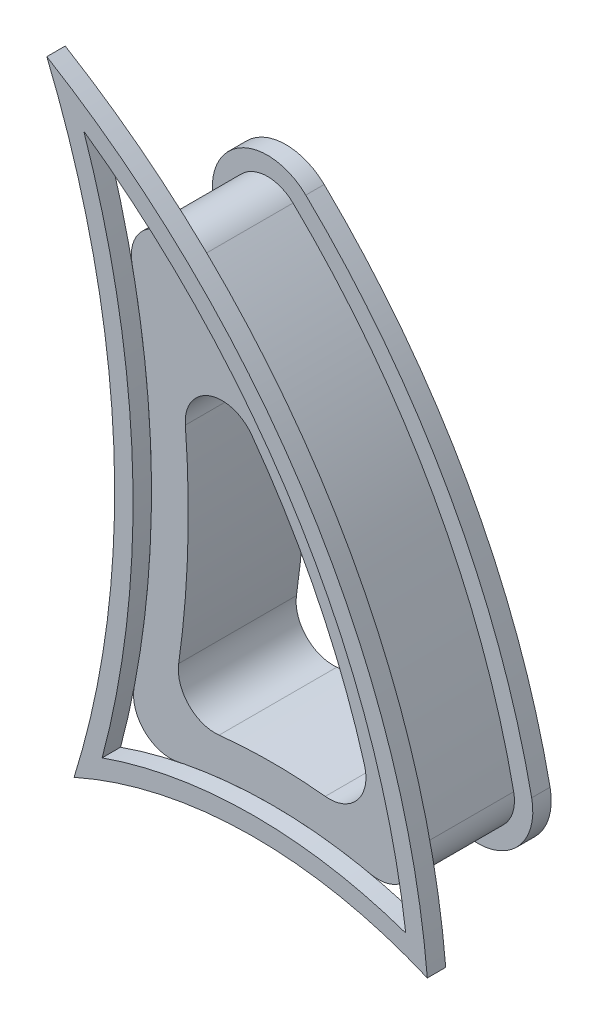
from build123d import *

# Parameters (mm, degrees)
BOSS_EXTRUDE1_DEPTH = 6.4
BOSS_EXTRUDE2_DEPTH = 1
BOSS_EXTRUDE3_START = 6.4
BOSS_EXTRUDE3_DEPTH = 1
FILLET1_R           = 2
FILLET2_R           = 2
FILLET3_R           = 3


with BuildPart() as part:
    # Sketch1 → Boss-Extrude1 (new body)
    with BuildSketch(Plane.XY):
        with BuildLine():
            ThreePointArc((-8.25, 0), (-6.599997803, 14.574138007), (-9.25, 29))
            ThreePointArc((-9.25, 29), (2.55299652, 16.342325486), (8.25, 0))
            ThreePointArc((8.25, 0), (0, 1.4004767), (-8.25, 0))
        make_face()
        with BuildLine():
            ThreePointArc((-5.546053811, 2.824732359), (0.107700878, 3.400261894), (5.7566842, 2.779646266))
            ThreePointArc((5.7566842, 2.779646266), (1.607801999, 13.980744157), (-5.663467174, 23.457371305))
            ThreePointArc((-5.663467174, 23.457371305), (-4.571139724, 13.146933818), (-5.546053811, 2.824732359))
        make_face(mode=Mode.SUBTRACT)
    extrude(amount=BOSS_EXTRUDE1_DEPTH)

    # Sketch1<3> → Boss-Extrude2 (add)
    with BuildSketch(Plane.XY):
        with BuildLine():
            ThreePointArc((-9.774519405, -1.680153546), (-7.619164248, 15.038837468), (-11.257417673, 31.498889971))
            ThreePointArc((-11.257417673, 31.498889971), (3.03782158, 17.463074836), (9.422096196, -1.526369849))
            ThreePointArc((9.422096196, -1.526369849), (-0.192257343, 0.399706627), (-9.774519405, -1.680153546))
        make_face()
        with BuildLine():
            ThreePointArc((-8.25, 0), (0, 1.4004767), (8.25, 0))
            ThreePointArc((8.25, 0), (2.55299652, 16.342325486), (-9.25, 29))
            ThreePointArc((-9.25, 29), (-6.599997803, 14.574138007), (-8.25, 0))
        make_face(mode=Mode.SUBTRACT)
    extrude(amount=BOSS_EXTRUDE2_DEPTH)

    # Fillet1
    fillet1_edges = [part.edges().sort_by_distance(p)[0] for p in [
        (-9.25, 29, 3.7),
        (8.25, 0, 3.7),
        (-8.25, 0, 3.7),
    ]]
    fillet(fillet1_edges, radius=FILLET1_R)

    # Fillet2
    fillet2_edges = [part.edges().sort_by_distance(p)[0] for p in [
        (5.7566842, 2.779646266, 3.2),
        (-5.663467174, 23.457371305, 3.2),
        (-5.546053811, 2.824732359, 3.2),
    ]]
    fillet(fillet2_edges, radius=FILLET2_R)

    # Fillet3
    fillet3_edges = [part.edges().sort_by_distance(p)[0] for p in [
        (-11.257417673, 31.498889971, 0.5),
        (-9.774519405, -1.680153546, 0.5),
        (9.422096196, -1.526369849, 0.5),
    ]]
    fillet(fillet3_edges, radius=FILLET3_R)


with BuildPart() as body_2:
    # Sketch1<4> → Boss-Extrude3 (new body)
    with BuildSketch(Plane.XY.offset(BOSS_EXTRUDE3_START)):
        with BuildLine():
            ThreePointArc((-9.774519405, -1.680153546), (-7.619164248, 15.038837468), (-11.257417673, 31.498889971))
            ThreePointArc((-11.257417673, 31.498889971), (3.03782158, 17.463074836), (9.422096196, -1.526369849))
            ThreePointArc((9.422096196, -1.526369849), (-0.192257343, 0.399706627), (-9.774519405, -1.680153546))
        make_face()
        with BuildLine():
            ThreePointArc((-8.25, 0), (0, 1.4004767), (8.25, 0))
            ThreePointArc((8.25, 0), (2.55299652, 16.342325486), (-9.25, 29))
            ThreePointArc((-9.25, 29), (-6.599997803, 14.574138007), (-8.25, 0))
        make_face(mode=Mode.SUBTRACT)
    extrude(amount=BOSS_EXTRUDE3_DEPTH)


solid = Compound([part.part, body_2.part])
